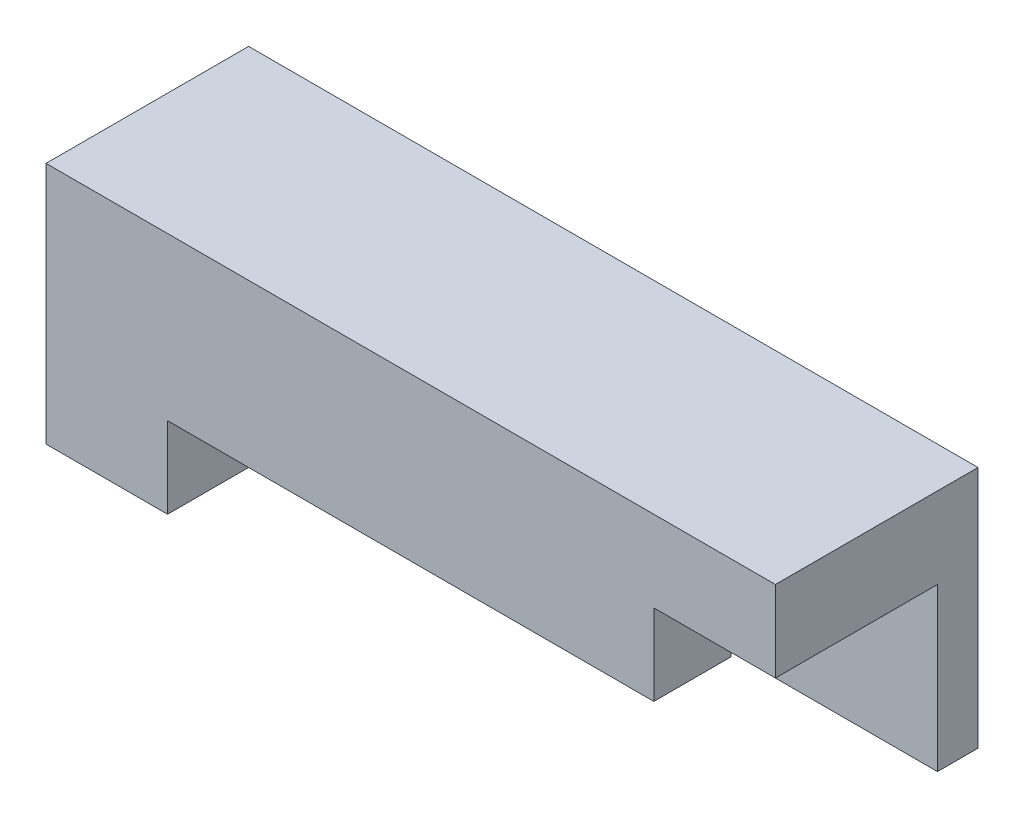
from build123d import *

# Parameters (mm, degrees)
SKETCH2_W           = 18
SKETCH2_H           = 5
BOSS_EXTRUDE1_DEPTH = 6
CUT_EXTRUDE1_DEPTH  = 15
CUT_EXTRUDE2_REACH  = 13.916
SKETCH4_W           = 3
SKETCH4_H           = 2


with BuildPart() as part:
    # Sketch2 → Boss-Extrude1 (new body)
    with BuildSketch(Plane(origin=(0, 0, 0), x_dir=(1, 0, 0), z_dir=(0, 1, 0))):
        Rectangle(SKETCH2_W, SKETCH2_H)
    extrude(amount=BOSS_EXTRUDE1_DEPTH)

    # Sketch3 → Cut-Extrude1 (cut)
    with BuildSketch(Plane(origin=(9, 0, 0), x_dir=(0, 0, -1), z_dir=(1, 0, 0))):
        Polygon((-2.5, 0), (1.5, 0), (1.5, 4), (-0.6, 4), (-0.6, 2), (-2.5, 2), align=None)
    extrude(amount=-CUT_EXTRUDE1_DEPTH, mode=Mode.SUBTRACT)

    # Sketch4 → Cut-Extrude2 (cut, up to next)
    with BuildSketch(Plane.XY.offset(2.5), mode=Mode.PRIVATE) as cut_extrude2_sk1:
        with Locations((7.5, 3)):
            Rectangle(SKETCH4_W, SKETCH4_H)
    cut_extrude2_tool1 = extrude(cut_extrude2_sk1.sketch, amount=-CUT_EXTRUDE2_REACH, mode=Mode.PRIVATE) & part.part
    add(cut_extrude2_tool1.solids().sort_by_distance((7.5, 3, 2.5))[0], mode=Mode.SUBTRACT)


solid = part.part
